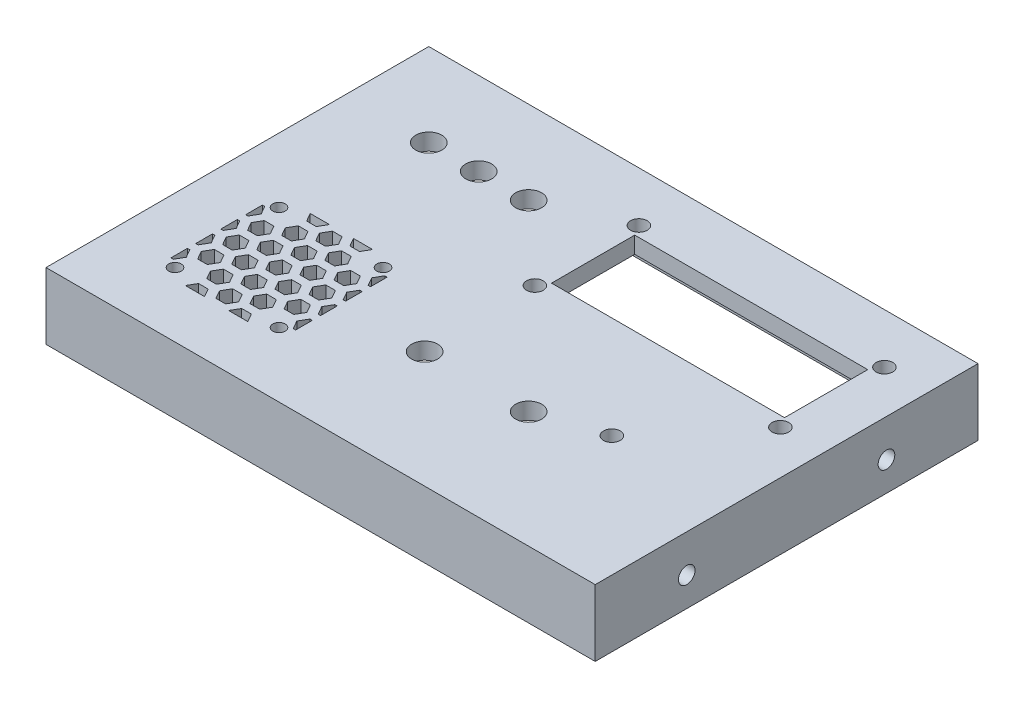
from build123d import *

# Parameters (mm, degrees)
SKETCH1_W                = 160.02
SKETCH1_H                = 109.22
BOSS_EXTRUDE1_DEPTH      = 5.08
SKETCH2_R                = 1.905
CUT_EXTRUDE2_DEPTH       = 5.08
SKETCH3_R                = 3.96875
SKETCH3_R_2              = 2.54
CUT_EXTRUDE3_DEPTH       = 5.08
EXTRUDE_THIN1_DEPTH      = 15.24
EXTRUDE_THIN1_DEPTH_BACK = 5.08
SKETCH4_W                = 167.64
SKETCH4_H                = 116.84
SKETCH4_W_2              = 160.02
SKETCH4_H_2              = 109.22
CUT_EXTRUDE4_DEPTH       = 175.600752862
CUT_EXTRUDE4_DEPTH_BACK  = 175.600752862
SKETCH5_R                = 2.54
SKETCH6_R                = 3.96875
CUT_EXTRUDE5_DEPTH       = 53.848
SKETCH7_R                = 2.54
SKETCH7_W                = 71.12
SKETCH7_H                = 25.4
CUT_EXTRUDE6_DEPTH       = 53.848


with BuildPart() as part:
    # Sketch1 → Boss-Extrude1 (new body)
    with BuildSketch(Plane(origin=(0, 0, 0), x_dir=(1, 0, 0), z_dir=(0, 1, 0))):
        Rectangle(SKETCH1_W, SKETCH1_H)
    extrude(amount=BOSS_EXTRUDE1_DEPTH)

    # Sketch2 → Cut-Extrude2 (cut)
    with BuildSketch(Plane(origin=(0, 5.08, 0), x_dir=(1, 0, 0), z_dir=(0, 1, 0))):
        Polygon((-51.926174209, -3.81), (-57.792052944, -3.81), (-56.325583261, -6.35), (-53.392643893, -6.35), align=None)
        Polygon((-66.590871047, -8.89), (-67.31, -8.89), (-67.31, -13.97), (-66.590871047, -13.97), (-65.124401363, -11.43), align=None)
        Polygon((-38.727947056, -3.81), (-44.593825791, -3.81), (-43.127356107, -6.35), (-40.194416739, -6.35), align=None)
        Polygon((-66.590871047, -16.51), (-67.31, -16.51), (-67.31, -21.59), (-66.590871047, -21.59), (-65.124401363, -19.05), align=None)
        Polygon((-66.590871047, -24.13), (-67.31, -24.13), (-67.31, -29.21), (-66.590871047, -29.21), (-65.124401363, -26.67), align=None)
        Polygon((-29.21, -13.97), (-29.21, -8.89), (-29.929128953, -8.89), (-31.395598637, -11.43), (-29.929128953, -13.97), align=None)
        Polygon((-66.590871047, -31.75), (-67.31, -31.75), (-67.31, -36.83), (-66.590871047, -36.83), (-65.124401363, -34.29), align=None)
        Polygon((-29.21, -21.59), (-29.21, -16.51), (-29.929128953, -16.51), (-31.395598637, -19.05), (-29.929128953, -21.59), align=None)
        Polygon((-29.21, -29.21), (-29.21, -24.13), (-29.929128953, -24.13), (-31.395598637, -26.67), (-29.929128953, -29.21), align=None)
        Polygon((-56.325583261, -39.37), (-57.792052944, -41.91), (-51.926174209, -41.91), (-53.392643893, -39.37), align=None)
        Polygon((-29.21, -36.83), (-29.21, -31.75), (-29.929128953, -31.75), (-31.395598637, -34.29), (-29.929128953, -36.83), align=None)
        Polygon((-43.127356107, -39.37), (-44.593825791, -41.91), (-38.727947056, -41.91), (-40.194416739, -39.37), align=None)
        Polygon((-43.127356107, -16.51), (-44.593825791, -19.05), (-43.127356107, -21.59), (-40.194416739, -21.59), (-38.727947056, -19.05), (-40.194416739, -16.51), align=None)
        Polygon((-46.793530316, -25.4), (-45.327060633, -22.86), (-46.793530316, -20.32), (-49.726469684, -20.32), (-51.192939367, -22.86), (-49.726469684, -25.4), align=None)
        Polygon((-33.595303163, -25.4), (-32.128833479, -22.86), (-33.595303163, -20.32), (-36.52824253, -20.32), (-37.994712214, -22.86), (-36.52824253, -25.4), align=None)
        Polygon((-46.793530316, -17.78), (-45.327060633, -15.24), (-46.793530316, -12.7), (-49.726469684, -12.7), (-51.192939367, -15.24), (-49.726469684, -17.78), align=None)
        Polygon((-33.595303163, -17.78), (-32.128833479, -15.24), (-33.595303163, -12.7), (-36.52824253, -12.7), (-37.994712214, -15.24), (-36.52824253, -17.78), align=None)
        Polygon((-46.793530316, -10.16), (-45.327060633, -7.62), (-46.793530316, -5.08), (-49.726469684, -5.08), (-51.192939367, -7.62), (-49.726469684, -10.16), align=None)
        with Locations((-32.385, -6.985)):
            Circle(SKETCH2_R)
        Polygon((-43.127356107, -8.89), (-44.593825791, -11.43), (-43.127356107, -13.97), (-40.194416739, -13.97), (-38.727947056, -11.43), (-40.194416739, -8.89), align=None)
        Polygon((-59.99175747, -25.4), (-58.525287786, -22.86), (-59.99175747, -20.32), (-62.924696837, -20.32), (-64.391166521, -22.86), (-62.924696837, -25.4), align=None)
        Polygon((-59.99175747, -17.78), (-58.525287786, -15.24), (-59.99175747, -12.7), (-62.924696837, -12.7), (-64.391166521, -15.24), (-62.924696837, -17.78), align=None)
        with Locations((-64.135, -6.985)):
            Circle(SKETCH2_R)
        Polygon((-56.325583261, -8.89), (-57.792052944, -11.43), (-56.325583261, -13.97), (-53.392643893, -13.97), (-51.926174209, -11.43), (-53.392643893, -8.89), align=None)
        Polygon((-56.325583261, -16.51), (-57.792052944, -19.05), (-56.325583261, -21.59), (-53.392643893, -21.59), (-51.926174209, -19.05), (-53.392643893, -16.51), align=None)
        Polygon((-59.99175747, -33.02), (-58.525287786, -30.48), (-59.99175747, -27.94), (-62.924696837, -27.94), (-64.391166521, -30.48), (-62.924696837, -33.02), align=None)
        Polygon((-56.325583261, -24.13), (-57.792052944, -26.67), (-56.325583261, -29.21), (-53.392643893, -29.21), (-51.926174209, -26.67), (-53.392643893, -24.13), align=None)
        Polygon((-46.793530316, -33.02), (-45.327060633, -30.48), (-46.793530316, -27.94), (-49.726469684, -27.94), (-51.192939367, -30.48), (-49.726469684, -33.02), align=None)
        Polygon((-43.127356107, -24.13), (-44.593825791, -26.67), (-43.127356107, -29.21), (-40.194416739, -29.21), (-38.727947056, -26.67), (-40.194416739, -24.13), align=None)
        Polygon((-33.595303163, -33.02), (-32.128833479, -30.48), (-33.595303163, -27.94), (-36.52824253, -27.94), (-37.994712214, -30.48), (-36.52824253, -33.02), align=None)
        with Locations((-64.135, -38.735)):
            Circle(SKETCH2_R)
        Polygon((-56.325583261, -31.75), (-57.792052944, -34.29), (-56.325583261, -36.83), (-53.392643893, -36.83), (-51.926174209, -34.29), (-53.392643893, -31.75), align=None)
        Polygon((-46.793530316, -40.64), (-45.327060633, -38.1), (-46.793530316, -35.56), (-49.726469684, -35.56), (-51.192939367, -38.1), (-49.726469684, -40.64), align=None)
        Polygon((-43.127356107, -31.75), (-44.593825791, -34.29), (-43.127356107, -36.83), (-40.194416739, -36.83), (-38.727947056, -34.29), (-40.194416739, -31.75), align=None)
        with Locations((-32.385, -38.735)):
            Circle(SKETCH2_R)
    extrude(amount=-CUT_EXTRUDE2_DEPTH, mode=Mode.SUBTRACT)

    # Sketch3 → Cut-Extrude3 (cut)
    with BuildSketch(Plane(origin=(0, 5.08, 0), x_dir=(1, 0, 0), z_dir=(0, 1, 0))):
        with Locations((-3.81, -22.86)):
            Circle(SKETCH3_R)
        with Locations((27.94, -22.86)):
            Circle(SKETCH3_R)
        with Locations((46.99, -16.51)):
            Circle(SKETCH3_R_2)
    extrude(amount=-CUT_EXTRUDE3_DEPTH, mode=Mode.SUBTRACT)

    # Sketch4 → Extrude-Thin1 (add, two sides: drawn at the far end of the back side and taken through both)
    with BuildSketch(Plane.XZ.offset(-EXTRUDE_THIN1_DEPTH_BACK)):
        Rectangle(SKETCH4_W, SKETCH4_H)
        Rectangle(SKETCH4_W_2, SKETCH4_H_2, mode=Mode.SUBTRACT)
    extrude(amount=EXTRUDE_THIN1_DEPTH + EXTRUDE_THIN1_DEPTH_BACK)

    # Sketch5 → Cut-Extrude4 (cut, two sides: drawn at the far end of the back side and taken through both)
    with BuildSketch(Plane(origin=(-80.01, 0, 0), x_dir=(0, 0, -1), z_dir=(1, 0, 0)).offset(-CUT_EXTRUDE4_DEPTH_BACK)):
        with Locations((-30.48, -6.35)):
            Circle(SKETCH5_R)
        with Locations((30.48, -6.35)):
            Circle(SKETCH5_R)
    extrude(amount=CUT_EXTRUDE4_DEPTH + CUT_EXTRUDE4_DEPTH_BACK, mode=Mode.SUBTRACT)

    # Sketch6 → Cut-Extrude5 (cut)
    with BuildSketch(Plane(origin=(0, 5.08, 0), x_dir=(1, 0, 0), z_dir=(0, 1, 0))):
        with Locations((-58.42, 33.02)):
            Circle(SKETCH6_R)
        with Locations((-43.18, 33.02)):
            Circle(SKETCH6_R)
        with Locations((-27.94, 33.02)):
            Circle(SKETCH6_R)
    extrude(amount=-CUT_EXTRUDE5_DEPTH, mode=Mode.SUBTRACT)

    # Sketch7 → Cut-Extrude6 (cut)
    with BuildSketch(Plane(origin=(0, 5.08, 0), x_dir=(1, 0, 0), z_dir=(0, 1, 0))):
        with Locations((-4.445, 43.18)):
            Circle(SKETCH7_R)
        with Locations((70.485, 43.18)):
            Circle(SKETCH7_R)
        with Locations((70.485, 11.43)):
            Circle(SKETCH7_R)
        with Locations((-4.445, 11.43)):
            Circle(SKETCH7_R)
        with Locations((33.02, 27.305)):
            Rectangle(SKETCH7_W, SKETCH7_H)
    extrude(amount=-CUT_EXTRUDE6_DEPTH, mode=Mode.SUBTRACT)


solid = part.part
